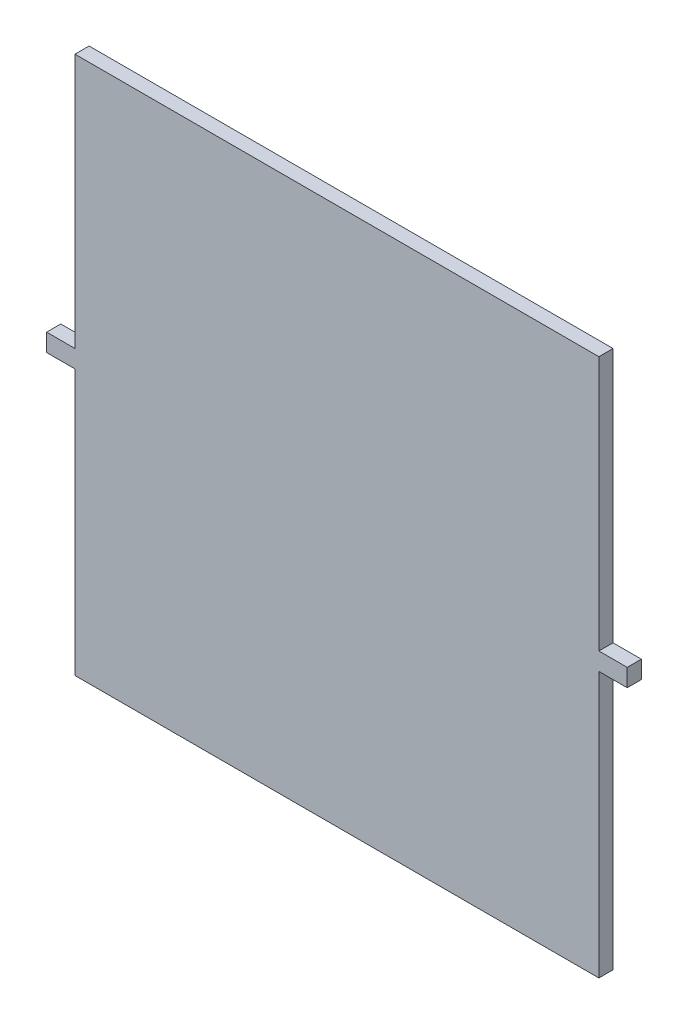
from build123d import *

# Parameters (mm, degrees)
SKETCH_1_W      = 8
SKETCH_1_H      = 5
SKETCH_1_W_2    = 148
SKETCH_1_H_2    = 75
EXTRUDE_1_DEPTH = 4


with BuildPart() as part:
    # Эскиз1 → Бобышка-Вытянуть1 (new body)
    with BuildSketch(Plane.XY):
        Polygon((0, 80), (0, 75), (148, 75), (148, 80), (148, 152), (0, 152), align=None)
        with Locations((-4, 77.5)):
            Rectangle(SKETCH_1_W, SKETCH_1_H)
        with Locations((74, 37.5)):
            Rectangle(SKETCH_1_W_2, SKETCH_1_H_2)
        with Locations((152, 77.5)):
            Rectangle(SKETCH_1_W, SKETCH_1_H)
    extrude(amount=EXTRUDE_1_DEPTH)


solid = part.part
